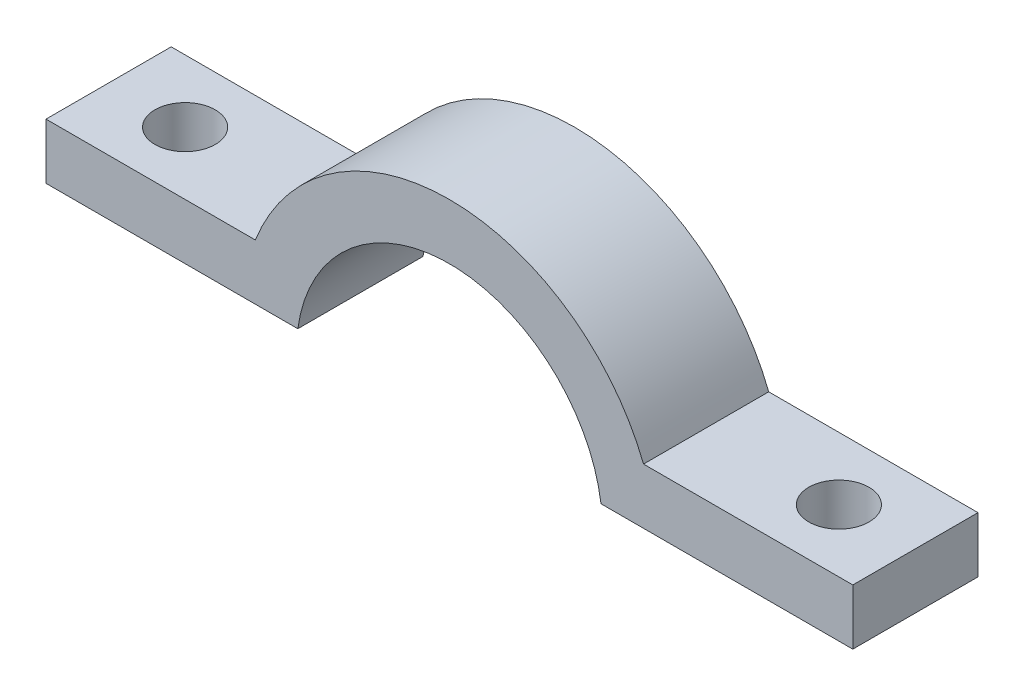
from build123d import *

# Parameters (mm, degrees)
BOSS_EXTRUDE1_DEPTH = 9
SKETCH2_R           = 2.165
CUT_EXTRUDE1_DEPTH  = 32.81587654


with BuildPart() as part:
    # Sketch1 → Boss-Extrude1 (new body)
    with BuildSketch(Plane.XY):
        with BuildLine():
            Line((29, -13.075), (29, -9.075))
            Line((29, -9.075), (13.955285737, -9.075))
            ThreePointArc((13.955285737, -9.075), (0, 0.425), (-13.955285737, -9.075))
            Line((-13.955285737, -9.075), (-29, -9.075))
            Line((-29, -9.075), (-29, -13.075))
            Line((-29, -13.075), (-10.897247359, -13.075))
            ThreePointArc((-10.897247359, -13.075), (0, -3.575), (10.897247359, -13.075))
            Line((10.897247359, -13.075), (29, -13.075))
        make_face()
    extrude(amount=BOSS_EXTRUDE1_DEPTH)

    # Sketch2 → Cut-Extrude1 (cut, through all)
    with BuildSketch(Plane(origin=(0, -9.075, 0), x_dir=(1, 0, 0), z_dir=(0, 1, 0))):
        with Locations(Location((-23.50000005, -4.5, 0), (0, 0, 180))):
            Circle(SKETCH2_R)
        with Locations(Location((23.50000005, -4.5, 0), (0, 0, 180))):
            Circle(SKETCH2_R)
    extrude(amount=-CUT_EXTRUDE1_DEPTH, mode=Mode.SUBTRACT)


solid = part.part
